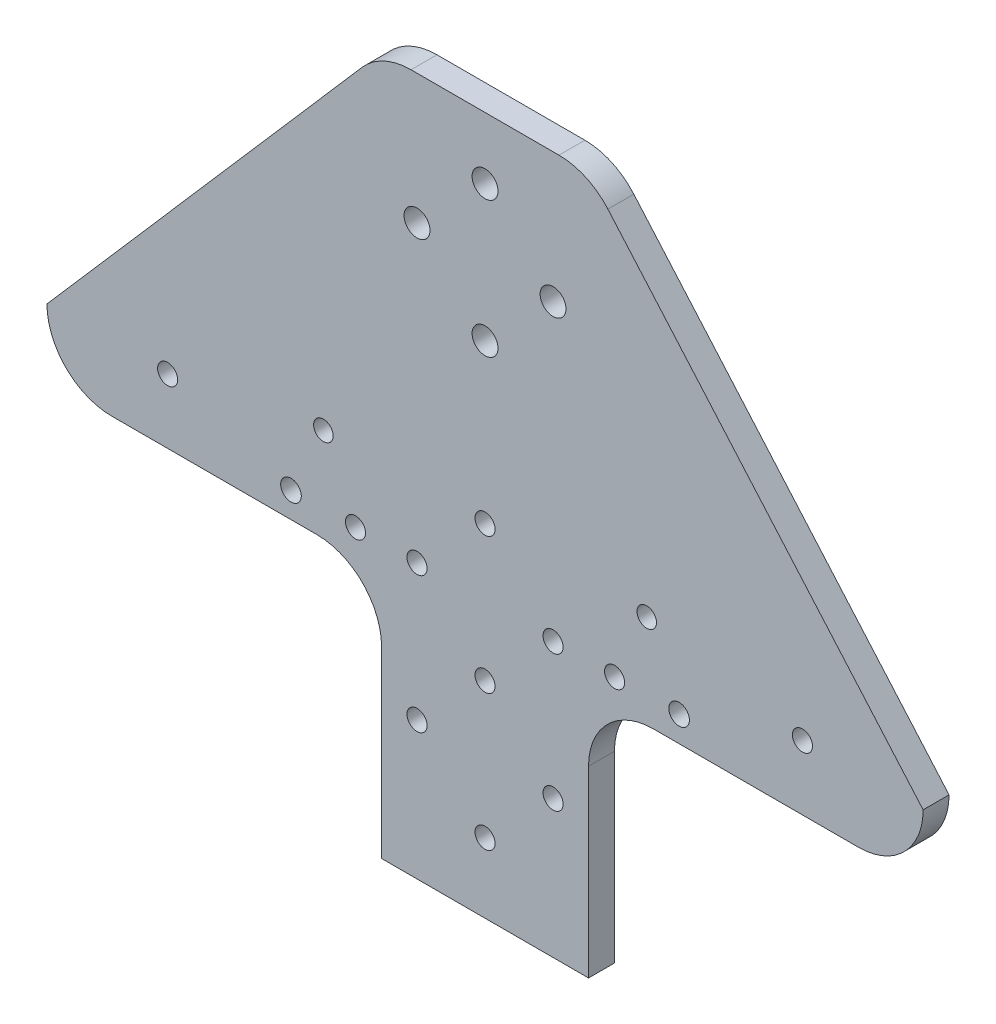
from build123d import *

# Parameters (mm, degrees)
SKETCH_1_R      = 1.55
SKETCH_1_R_2    = 1.593407699
SKETCH_1_R_3    = 1.506592301
SKETCH_1_R_4    = 1.546583653
SKETCH_1_R_5    = 2
EXTRUDE_1_DEPTH = 4


with BuildPart() as part:
    # 草图1 → 凸台-拉伸1 (new body)
    with BuildSketch(Plane.XY):
        with BuildLine():
            Line((-49.086064172, -18.127823684), (-41.682309555, -18.127823684))
            Line((-41.682309555, -18.127823684), (-17.432309555, -18.127823684))
            ThreePointArc((-17.432309555, -18.127823684), (-10.361241743, -21.056755872), (-7.432309555, -28.127823684))
            Line((-7.432309555, -28.127823684), (-7.432309555, -56.439146577))
            Line((-7.432309555, -56.439146577), (24.519698232, -56.439146577))
            Line((24.519698232, -56.439146577), (24.519698232, -28.127823684))
            ThreePointArc((24.519698232, -28.127823684), (27.44863042, -21.056755872), (34.519698232, -18.127823684))
            Line((34.519698232, -18.127823684), (58.769698232, -18.127823684))
            Line((58.769698232, -18.127823684), (66.173452848, -18.127823684))
            ThreePointArc((66.173452848, -18.127823684), (73.24452066, -15.198891495), (76.173452848, -8.127823684))
            Line((76.173452848, -8.127823684), (27.509504294, 47.847762189))
            ThreePointArc((27.509504294, 47.847762189), (24.109445562, 50.386499783), (19.962749895, 51.28677918))
            Line((19.962749895, 51.28677918), (8.543694338, 51.28677918))
            Line((8.543694338, 51.28677918), (-2.875361218, 51.28677918))
            ThreePointArc((-2.875361218, 51.28677918), (-7.022056885, 50.386499783), (-10.422115617, 47.847762189))
            Line((-10.422115617, 47.847762189), (-59.086064172, -8.127823684))
            ThreePointArc((-59.086064172, -8.127823684), (-56.157131983, -15.198891495), (-49.086064172, -18.127823684))
        make_face()
        with Locations((-1.956305662, -35.174209618)):
            Circle(SKETCH_1_R, mode=Mode.SUBTRACT)
        with Locations((-40.456305662, -8.174209618)):
            Circle(SKETCH_1_R, mode=Mode.SUBTRACT)
        with Locations((-21.414481972, -14.185828882)):
            Circle(SKETCH_1_R_2, mode=Mode.SUBTRACT)
        with Locations((-11.456305662, -14.174209618)):
            Circle(SKETCH_1_R, mode=Mode.SUBTRACT)
        with Locations((-16.414481972, -3.685828882)):
            Circle(SKETCH_1_R_3, mode=Mode.SUBTRACT)
        with Locations((-1.956305662, -14.174209618)):
            Circle(SKETCH_1_R, mode=Mode.SUBTRACT)
        with Locations((8.543694338, -45.674209618)):
            Circle(SKETCH_1_R, mode=Mode.SUBTRACT)
        with Locations((19.043694338, -35.174209618)):
            Circle(SKETCH_1_R, mode=Mode.SUBTRACT)
        with Locations((8.543694338, -24.674209618)):
            Circle(SKETCH_1_R_4, mode=Mode.SUBTRACT)
        with Locations((19.043694338, -14.174209618)):
            Circle(SKETCH_1_R, mode=Mode.SUBTRACT)
        with Locations((8.543694338, -3.674209618)):
            Circle(SKETCH_1_R, mode=Mode.SUBTRACT)
        with Locations((28.543694338, -14.174209618)):
            Circle(SKETCH_1_R, mode=Mode.SUBTRACT)
        with Locations((38.501870648, -14.185828882)):
            Circle(SKETCH_1_R_2, mode=Mode.SUBTRACT)
        with Locations((33.501870648, -3.685828882)):
            Circle(SKETCH_1_R_3, mode=Mode.SUBTRACT)
        with Locations((57.543694338, -8.174209618)):
            Circle(SKETCH_1_R, mode=Mode.SUBTRACT)
        with Locations((-1.956305662, 31.263738804)):
            Circle(SKETCH_1_R_5, mode=Mode.SUBTRACT)
        with Locations((8.543694338, 20.763738804)):
            Circle(SKETCH_1_R_5, mode=Mode.SUBTRACT)
        with Locations((19.043694338, 31.263738804)):
            Circle(SKETCH_1_R_5, mode=Mode.SUBTRACT)
        with Locations((8.543694338, 41.763738804)):
            Circle(SKETCH_1_R_5, mode=Mode.SUBTRACT)
    extrude(amount=EXTRUDE_1_DEPTH)


solid = part.part
